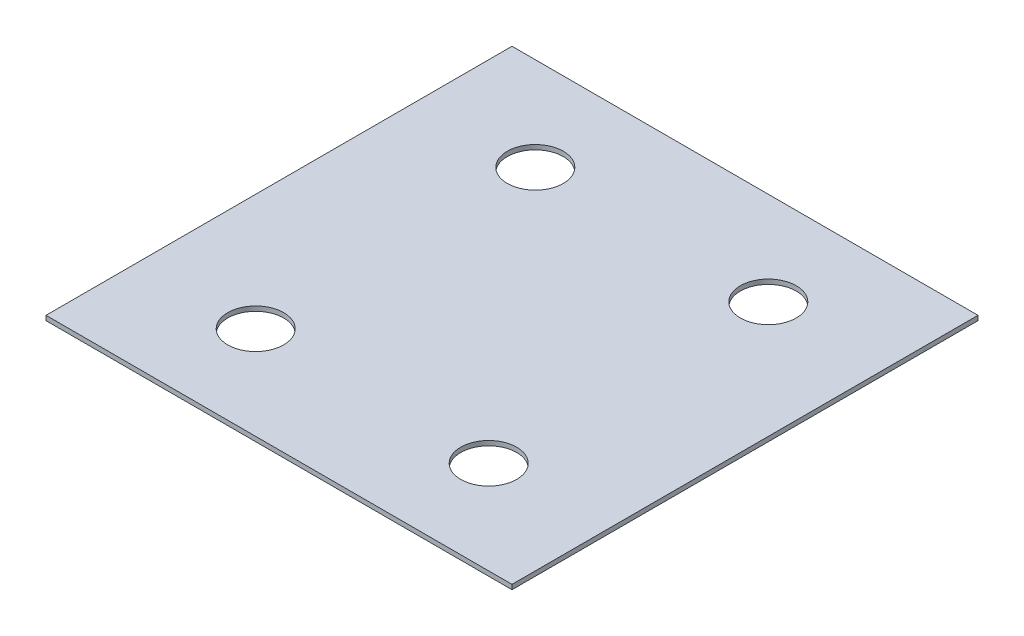
from build123d import *

# Parameters (mm, degrees)
SKETCH1_W               = 500
SKETCH1_H               = 500
BOSS_EXTRUDE1_DEPTH     = 5
CUT_EXTRUDE1_DEPTH      = 354.588744165
CUT_EXTRUDE1_DEPTH_BACK = 354.588744165
SKETCH2_R               = 30


with BuildPart() as part:
    # Sketch1 → Boss-Extrude1 (new body)
    with BuildSketch(Plane(origin=(0, 0, 0), x_dir=(1, 0, 0), z_dir=(0, 1, 0))):
        Rectangle(SKETCH1_W, SKETCH1_H)
    extrude(amount=BOSS_EXTRUDE1_DEPTH)

    # Sketch2 → Cut-Extrude1 (cut, two sides: drawn at the far end of the back side and taken through both)
    with BuildSketch(Plane(origin=(0, 5, 0), x_dir=(1, 0, 0), z_dir=(0, 1, 0)).offset(-CUT_EXTRUDE1_DEPTH_BACK)):
        with Locations(Location((-125, -150, 0), (0, 0, 270))):
            Circle(SKETCH2_R)
        with Locations(Location((125, -150, 0), (0, 0, 270))):
            Circle(SKETCH2_R)
        with Locations(Location((125, 150, 0), (0, 0, 270))):
            Circle(SKETCH2_R)
        with Locations(Location((-125, 150, 0), (0, 0, 270))):
            Circle(SKETCH2_R)
    extrude(amount=CUT_EXTRUDE1_DEPTH + CUT_EXTRUDE1_DEPTH_BACK, mode=Mode.SUBTRACT)


solid = part.part
